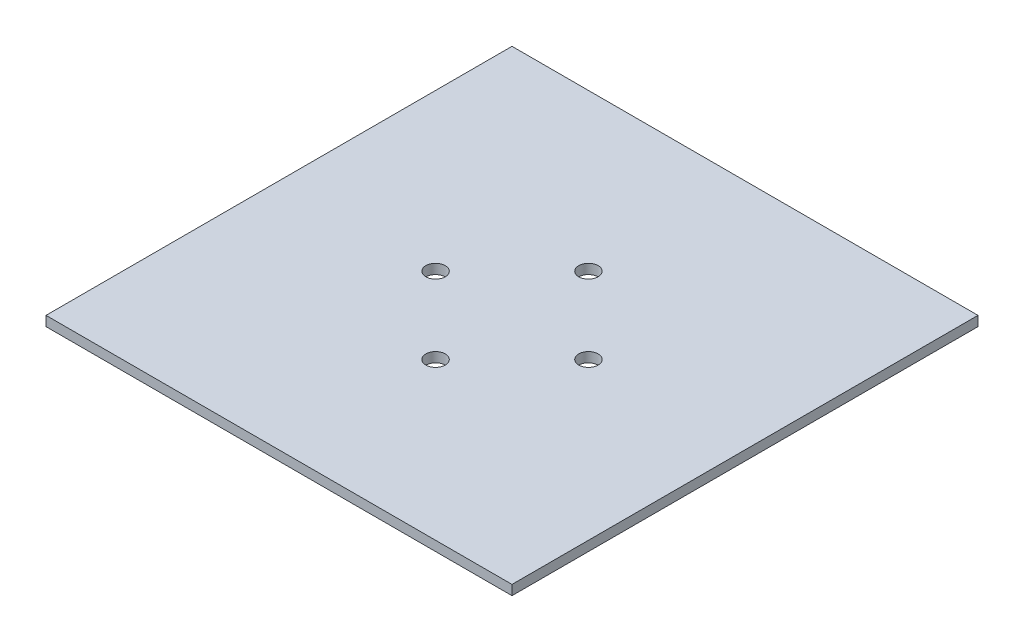
from build123d import *

# Parameters (mm, degrees)
SKETCH1_W                    = 76.2
SKETCH1_H                    = 76.2
BOSS_EXTRUDE1_DEPTH          = 1.6002
F_1_8_0_125_DIAMETER_HOLE1_D = 3.175


with BuildPart() as part:
    # Sketch1 → Boss-Extrude1 (new body)
    with BuildSketch(Plane(origin=(0, 0, 0), x_dir=(1, 0, 0), z_dir=(0, 1, 0))):
        Rectangle(SKETCH1_W, SKETCH1_H)
    extrude(amount=BOSS_EXTRUDE1_DEPTH)

    # 1/8 (0.125) Diameter Hole1 (through all)
    with Locations(Plane(origin=(0, 0, 0), x_dir=(-1, 0, 0), z_dir=(0, -1, 0))):
        with Locations((0, 12.5), (0, -12.5), (12.5, 0), (-12.5, 0)):
            Hole(F_1_8_0_125_DIAMETER_HOLE1_D / 2)


solid = part.part
